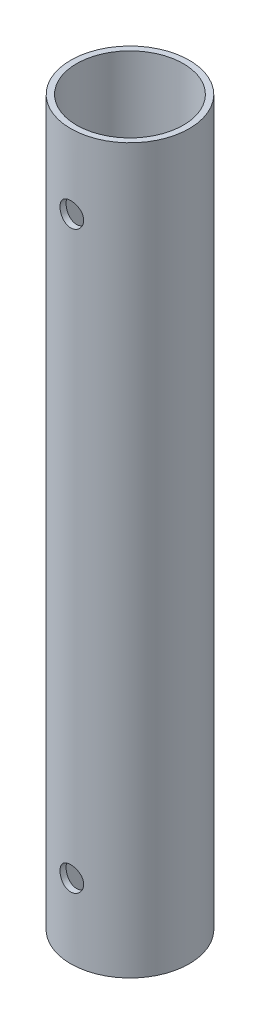
from build123d import *

# Parameters (mm, degrees)
SKETCH1_R           = 10
SKETCH1_R_2         = 9
BOSS_EXTRUDE1_DEPTH = 122
SKETCH3_R           = 2
CUT_EXTRUDE2_DEPTH  = 125.03225387


with BuildPart() as part:
    # Sketch1 → Boss-Extrude1 (new body)
    with BuildSketch(Plane(origin=(0, 0, 0), x_dir=(1, 0, 0), z_dir=(0, 1, 0))):
        with Locations(Location((0, 0, 0), (0, 0, 90))):
            Circle(SKETCH1_R)
        with Locations(Location((0, 0, 0), (0, 0, 90))):
            Circle(SKETCH1_R_2, mode=Mode.SUBTRACT)
    extrude(amount=BOSS_EXTRUDE1_DEPTH)

    # Sketch3 → Cut-Extrude2 (cut, through all)
    with BuildSketch(Plane.XY.offset(10)):
        with Locations((0, 109.5)):
            Circle(SKETCH3_R)
        with Locations((0, 12.5)):
            Circle(SKETCH3_R)
    extrude(amount=-CUT_EXTRUDE2_DEPTH, mode=Mode.SUBTRACT)


solid = part.part
